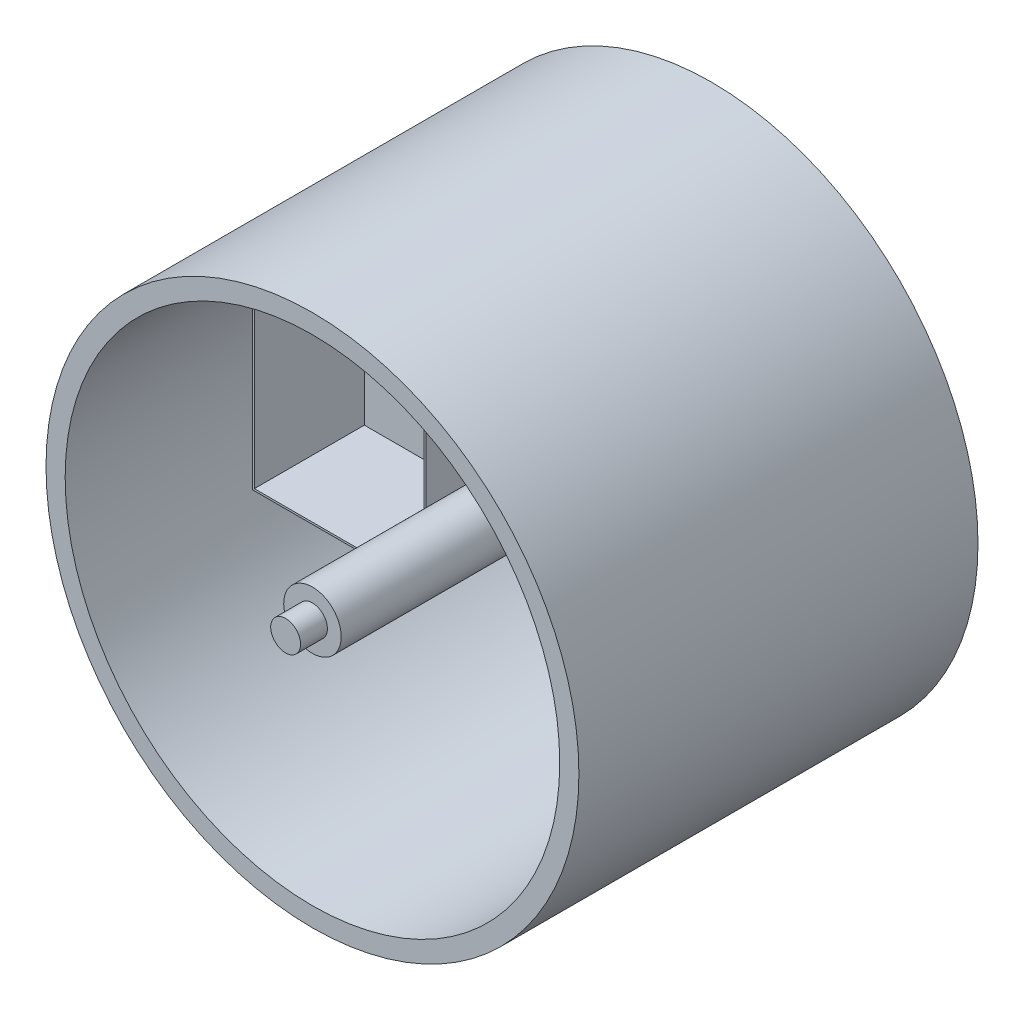
from build123d import *

# Parameters (mm, degrees)
SKETCH1_R                       = 69.53
SKETCH1_W                       = 42.3
SKETCH1_H                       = 42.3
BOSS_EXTRUDE1_DEPTH             = 104.14
SHELL1_T                        = -5
SKETCH1_4_W                     = 42.3
SKETCH1_4_H                     = 42.3
BOSS_EXTRUDE3_DEPTH             = 31.14
SKETCH2_W                       = 45.3
SKETCH2_H                       = 45.3
BOSS_EXTRUDE5_DEPTH             = 28.7
BOSS_EXTRUDE5_DIRECTION_2_REACH = 124.466
CUT_EXTRUDE1_START              = -28.7
SKETCH3_W                       = 44.3
SKETCH3_H                       = 44.3
CUT_EXTRUDE1_DEPTH              = 28.7
SKETCH4_R                       = 7.5
BOSS_EXTRUDE6_DEPTH             = 99.14
SKETCH5_R                       = 3.9
BOSS_EXTRUDE7_DEPTH             = 7


with BuildPart() as part:
    # Sketch1 → Boss-Extrude1 (new body)
    # profile 1 of 2: a face of its own
    with BuildSketch(Plane.XY):
        Circle(SKETCH1_R)
        with Locations((-37.305, 0)):
            Rectangle(SKETCH1_W, SKETCH1_H, mode=Mode.SUBTRACT)
    # profile 2 of 2: a face of its own
    with BuildSketch(Plane.XY):
        with Locations((-37.305, 0)):
            Rectangle(SKETCH1_W, SKETCH1_H)
    extrude(amount=BOSS_EXTRUDE1_DEPTH)

    # Shell1
    shell1_openings = [part.faces().sort_by_distance(p)[0] for p in [
        (0, 0, 104.14),
    ]]
    offset(amount=SHELL1_T, openings=shell1_openings, kind=Kind.INTERSECTION)

    # Sketch1<4> → Boss-Extrude3 (add)
    with BuildSketch(Plane.XY):
        with Locations((-37.305, 0)):
            Rectangle(SKETCH1_4_W, SKETCH1_4_H)
    extrude(amount=BOSS_EXTRUDE3_DEPTH)

    # Sketch2 → Boss-Extrude5 (add)
    with BuildSketch(Plane.XY.offset(31.14)):
        with Locations((-37.305, 0)):
            Rectangle(SKETCH2_W, SKETCH2_H)
        with BuildLine():
            Line((-58.455, -20.754129107), (-58.455, 20.754129107))
            ThreePointArc((-58.455, 20.754129107), (-58.384303073, 20.952184962), (-58.3129351, 21.15))
            Line((-58.3129351, 21.15), (-16.155, 21.15))
            Line((-16.155, 21.15), (-16.155, -21.15))
            Line((-16.155, -21.15), (-58.3129351, -21.15))
            ThreePointArc((-58.3129351, -21.15), (-58.384303073, -20.952184962), (-58.455, -20.754129107))
        make_face(mode=Mode.SUBTRACT)
    extrude(amount=BOSS_EXTRUDE5_DEPTH)

    # Sketch2 → Boss-Extrude5 direction 2 (add, up to next)
    with BuildSketch(Plane.XY.offset(31.14), mode=Mode.PRIVATE) as boss_extrude5_direction_2_sk1:
        with Locations((-37.305, 0)):
            Rectangle(SKETCH2_W, SKETCH2_H)
        with BuildLine():
            Line((-58.455, -20.754129107), (-58.455, 20.754129107))
            ThreePointArc((-58.455, 20.754129107), (-58.384303073, 20.952184962), (-58.3129351, 21.15))
            Line((-58.3129351, 21.15), (-16.155, 21.15))
            Line((-16.155, 21.15), (-16.155, -21.15))
            Line((-16.155, -21.15), (-58.3129351, -21.15))
            ThreePointArc((-58.3129351, -21.15), (-58.384303073, -20.952184962), (-58.455, -20.754129107))
        make_face(mode=Mode.SUBTRACT)
    boss_extrude5_direction_2_tool1 = extrude(boss_extrude5_direction_2_sk1.sketch, amount=-BOSS_EXTRUDE5_DIRECTION_2_REACH, mode=Mode.PRIVATE) - part.part
    add(boss_extrude5_direction_2_tool1.solids().sort_by_distance((-37.305, -22.009361, 31.14))[0])

    # Sketch3 → Cut-Extrude1 (cut)
    with BuildSketch(Plane.XY.offset(59.84).offset(CUT_EXTRUDE1_START)):
        with Locations((-37.305, 0)):
            Rectangle(SKETCH3_W, SKETCH3_H)
        with BuildLine():
            Line((-16.155, -21.15), (-58.3129351, -21.15))
            ThreePointArc((-58.3129351, -21.15), (-58.384303073, -20.952184962), (-58.455, -20.754129107))
            Line((-58.455, -20.754129107), (-58.455, 20.754129107))
            ThreePointArc((-58.455, 20.754129107), (-58.384303073, 20.952184962), (-58.3129351, 21.15))
            Line((-58.3129351, 21.15), (-16.155, 21.15))
            Line((-16.155, 21.15), (-16.155, -21.15))
        make_face(mode=Mode.SUBTRACT)
    extrude(amount=CUT_EXTRUDE1_DEPTH, mode=Mode.SUBTRACT)

    # Sketch4 → Boss-Extrude6 (add)
    with BuildSketch(Plane.XY.offset(5)):
        with Locations(Location((0, 0, 0), (0, 0, 180))):
            Circle(SKETCH4_R)
    extrude(amount=BOSS_EXTRUDE6_DEPTH)

    # Sketch5 → Boss-Extrude7 (add)
    with BuildSketch(Plane.XY.offset(104.14)):
        Circle(SKETCH5_R)
    extrude(amount=BOSS_EXTRUDE7_DEPTH)


solid = part.part
